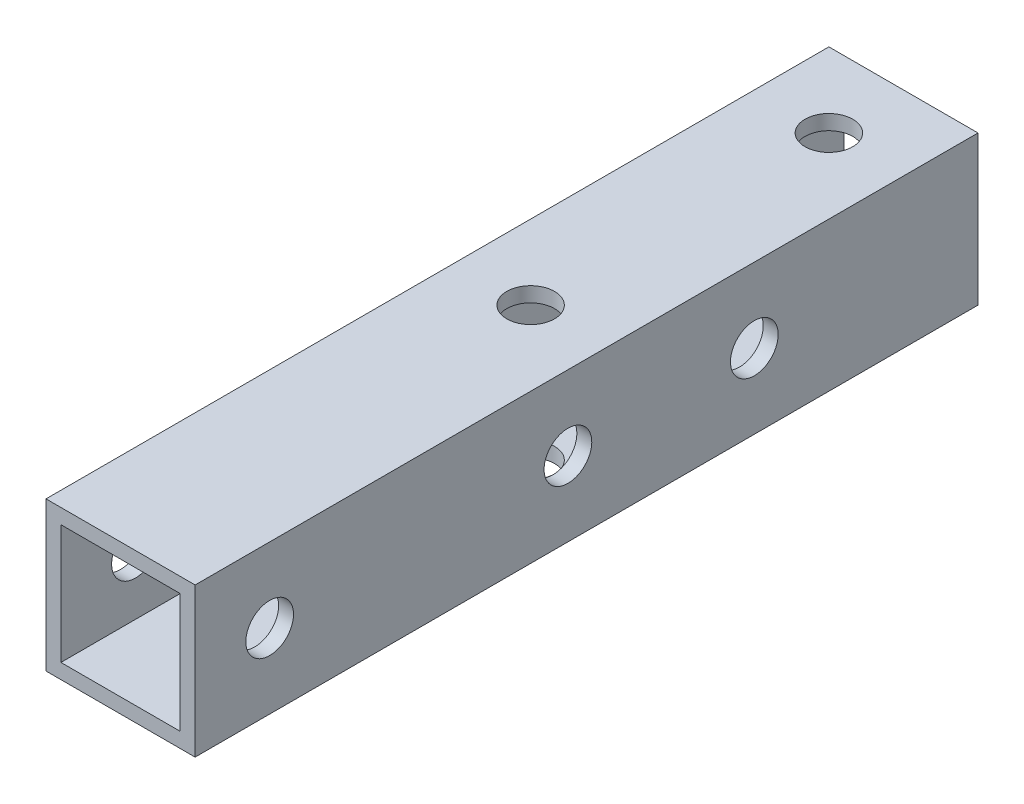
from build123d import *

# Parameters (mm, degrees)
SKETCH_1_W          = 10
SKETCH_1_H          = 10
SKETCH_1_W_2        = 8
SKETCH_1_H_2        = 8
EXTRUDE_1_DEPTH     = 52.5
SKETCH_2_R          = 1.6
CUT_EXTRUDE_1_DEPTH = 54.677276384
SKETCH_3_R          = 1.6
CUT_EXTRUDE_2_DEPTH = 54.677276384
SKETCH_4_R          = 1.6
CUT_EXTRUDE_3_DEPTH = 54.677276384


with BuildPart() as part:
    # ｽｹｯﾁ1 → 押し出し-薄板1 (new body)
    with BuildSketch(Plane.XY):
        Rectangle(SKETCH_1_W, SKETCH_1_H)
        Rectangle(SKETCH_1_W_2, SKETCH_1_H_2, mode=Mode.SUBTRACT)
    extrude(amount=EXTRUDE_1_DEPTH)

    # ｽｹｯﾁ2 → ｶｯﾄ - 押し出し1 (cut, through all)
    with BuildSketch(Plane(origin=(0, 5, 0), x_dir=(1, 0, 0), z_dir=(0, 1, 0))):
        with Locations(Location((0, -5, 0), (0, 0, 180))):
            Circle(SKETCH_2_R)
        with Locations(Location((0, -25, 0), (0, 0, 180))):
            Circle(SKETCH_2_R)
    extrude(amount=-CUT_EXTRUDE_1_DEPTH, mode=Mode.SUBTRACT)

    # ｽｹｯﾁ3 → ｶｯﾄ - 押し出し2 (cut, through all)
    with BuildSketch(Plane(origin=(5, 0, 0), x_dir=(0, 0, -1), z_dir=(1, 0, 0))):
        with Locations(Location((-47.5, 0, 0), (0, 0, 90))):
            Circle(SKETCH_3_R)
        with Locations(Location((-27.5, 0, 0), (0, 0, 90))):
            Circle(SKETCH_3_R)
    extrude(amount=-CUT_EXTRUDE_2_DEPTH, mode=Mode.SUBTRACT)

    # ｽｹｯﾁ4 → ｶｯﾄ - 押し出し3 (cut, through all)
    with BuildSketch(Plane.ZY.offset(5)):
        with Locations(Location((15, 0, 0), (0, 0, 270))):
            Circle(SKETCH_4_R)
    extrude(amount=-CUT_EXTRUDE_3_DEPTH, mode=Mode.SUBTRACT)


solid = part.part
